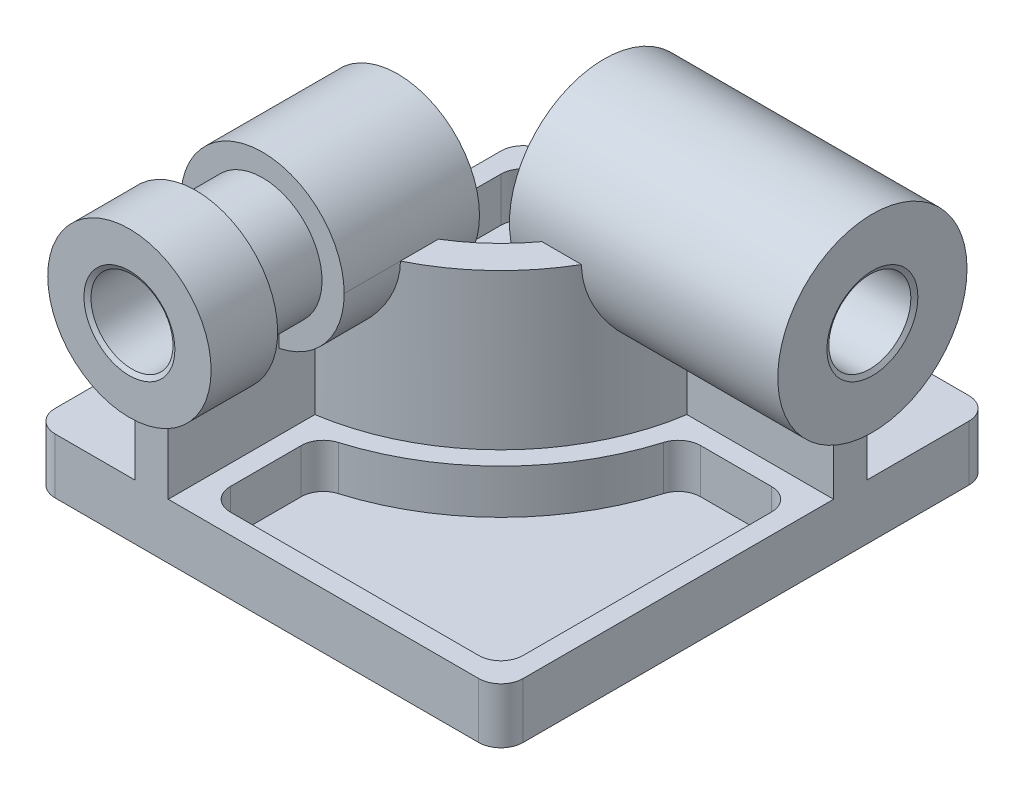
from build123d import *
from OCP.BRepFilletAPI import BRepFilletAPI_MakeChamfer

# Parameters (mm, degrees)
BOSS_EXTRUDE1_DEPTH = 25
BOSS_EXTRUDE2_START = -25
BOSS_EXTRUDE2_DEPTH = 95
BOSS_EXTRUDE4_START = 10
SKETCH7_R           = 36.833333333
BOSS_EXTRUDE4_DEPTH = 121
BOSS_EXTRUDE5_START = 10
SKETCH8_R           = 42.666666667
BOSS_EXTRUDE5_DEPTH = 121
CUT_EXTRUDE2_REACH  = 322.84
SKETCH9_R           = 18.5
CUT_EXTRUDE3_REACH  = 315.717
SKETCH10_R          = 18.5
CHAMFER1_SIZE       = 2
CHAMFER1_SIZE2      = 1.154700538
CUT_EXTRUDE4_START  = -30
CUT_EXTRUDE4_DEPTH  = 30
CUT_EXTRUDE5_DEPTH  = 20
CUT_EXTRUDE7_DEPTH  = 20


with BuildPart() as part:
    # Sketch1 → Boss-Extrude1 (new body)
    with BuildSketch(Plane(origin=(0, 0, 0), x_dir=(1, 0, 0), z_dir=(0, 1, 0))):
        with BuildLine():
            Line((-36, 56), (155, 56))
            ThreePointArc((155, 56), (162.071067812, 53.071067812), (165, 46))
            Line((165, 46), (165, -155))
            ThreePointArc((165, -155), (162.071067812, -162.071067812), (155, -165))
            Line((155, -165), (-36, -165))
            ThreePointArc((-36, -165), (-43.071067812, -162.071067812), (-46, -155))
            Line((-46, -155), (-46, 46))
            ThreePointArc((-46, 46), (-43.071067812, 53.071067812), (-36, 56))
        make_face()
    extrude(amount=BOSS_EXTRUDE1_DEPTH)

    # Sketch2 → Boss-Extrude2 (add)
    with BuildSketch(Plane(origin=(0, 25, 0), x_dir=(1, 0, 0), z_dir=(0, 1, 0)).offset(BOSS_EXTRUDE2_START)):
        with BuildLine():
            Line((0, -85), (0, -165))
            Line((0, -165), (15, -165))
            Line((15, -165), (15, -98.868599666))
            ThreePointArc((15, -98.868599666), (70.710678119, -70.710678119), (98.868599666, -15))
            Line((98.868599666, -15), (165, -15))
            Line((165, -15), (165, 0))
            Line((165, 0), (85, 0))
            ThreePointArc((85, 0), (60.104076401, -60.104076401), (0, -85))
        make_face()
    extrude(amount=BOSS_EXTRUDE2_DEPTH)

    # Sketch7 → Boss-Extrude4 (add)
    with BuildSketch(Plane.XY.offset(165).offset(BOSS_EXTRUDE4_START)):
        with Locations((7.5, 95)):
            Circle(SKETCH7_R)
    extrude(amount=-BOSS_EXTRUDE4_DEPTH)

    # Sketch8 → Boss-Extrude5 (add)
    with BuildSketch(Plane(origin=(165, 0, 0), x_dir=(0, 0, -1), z_dir=(1, 0, 0)).offset(BOSS_EXTRUDE5_START)):
        with Locations((-7.5, 95)):
            Circle(SKETCH8_R)
    extrude(amount=-BOSS_EXTRUDE5_DEPTH)

    # Sketch9 → Cut-Extrude2 (cut, up to next)
    with BuildSketch(Plane.XY.offset(175), mode=Mode.PRIVATE) as cut_extrude2_sk1:
        with Locations((7.5, 95)):
            Circle(SKETCH9_R)
    cut_extrude2_tool1 = extrude(cut_extrude2_sk1.sketch, amount=-CUT_EXTRUDE2_REACH, mode=Mode.PRIVATE) & part.part
    add(cut_extrude2_tool1.solids().sort_by_distance((7.5, 95, 175))[0], mode=Mode.SUBTRACT)

    # Sketch10 → Cut-Extrude3 (cut, up to next)
    with BuildSketch(Plane(origin=(175, 0, 0), x_dir=(0, 0, -1), z_dir=(1, 0, 0)), mode=Mode.PRIVATE) as cut_extrude3_sk1:
        with Locations((-7.5, 95)):
            Circle(SKETCH10_R)
    cut_extrude3_tool1 = extrude(cut_extrude3_sk1.sketch, amount=-CUT_EXTRUDE3_REACH, mode=Mode.PRIVATE) & part.part
    add(cut_extrude3_tool1.solids().sort_by_distance((175, 95, 7.5))[0], mode=Mode.SUBTRACT)

    # Chamfer1: one chamfer whose edges measure the first distance from different faces: ONE call of the kernel's chamfer builder (chamfer() names one face for all edges)
    chamfer1_edges_1 = [part.edges().sort_by_distance(p)[0] for p in [
        (-11, 95, 175),
    ]]
    chamfer1_side_1 = [part.faces().sort_by_distance(p)[0] for p in [
        (-28.291529342, 95, 175),
    ]]
    chamfer1_edges_2 = [part.edges().sort_by_distance(p)[0] for p in [
        (-11, 95, 54),
    ]]
    chamfer1_side_2 = [part.faces().sort_by_distance(p)[0] for p in [
        (-28.291529342, 95, 54),
    ]]
    chamfer1_edges_3 = [part.edges().sort_by_distance(p)[0] for p in [
        (175, 95, 26),
    ]]
    chamfer1_side_3 = [part.faces().sort_by_distance(p)[0] for p in [
        (175, 95, 48.959871093),
    ]]
    chamfer1_edges_4 = [part.edges().sort_by_distance(p)[0] for p in [
        (54, 95, 26),
    ]]
    chamfer1_side_4 = [part.faces().sort_by_distance(p)[0] for p in [
        (54, 95, 48.959871093),
    ]]
    chamfer1 = BRepFilletAPI_MakeChamfer(part.part.solid().wrapped)
    for e in chamfer1_edges_1:
        chamfer1.Add(CHAMFER1_SIZE, CHAMFER1_SIZE2, e.wrapped, chamfer1_side_1[0].wrapped)  # the first distance lies on this face
    for e in chamfer1_edges_2:
        chamfer1.Add(CHAMFER1_SIZE, CHAMFER1_SIZE2, e.wrapped, chamfer1_side_2[0].wrapped)  # the first distance lies on this face
    for e in chamfer1_edges_3:
        chamfer1.Add(CHAMFER1_SIZE, CHAMFER1_SIZE2, e.wrapped, chamfer1_side_3[0].wrapped)  # the first distance lies on this face
    for e in chamfer1_edges_4:
        chamfer1.Add(CHAMFER1_SIZE, CHAMFER1_SIZE2, e.wrapped, chamfer1_side_4[0].wrapped)  # the first distance lies on this face
    add(Compound.cast(chamfer1.Shape()), mode=Mode.REPLACE)

    # Sketch11 → Cut-Extrude4 (cut)
    with BuildSketch(Plane.XY.offset(175).offset(CUT_EXTRUDE4_START)):
        with BuildLine():
            Line((0, 58.938324437), (0, 69.236114855))
            ThreePointArc((0, 69.236114855), (7.5, 121.833333333), (15, 69.236114855))
            Line((15, 69.236114855), (15, 58.938324437))
            ThreePointArc((15, 58.938324437), (7.5, 131.833333333), (0, 58.938324437))
        make_face()
    extrude(amount=-CUT_EXTRUDE4_DEPTH, mode=Mode.SUBTRACT)

    # Sketch12 → Cut-Extrude5 (cut)
    with BuildSketch(Plane(origin=(0, 25, 0), x_dir=(1, 0, 0), z_dir=(0, 1, 0))):
        with BuildLine():
            Line((24, -114.039466852), (24, -146))
            ThreePointArc((24, -146), (26.928932188, -153.071067812), (34, -156))
            Line((34, -156), (146, -156))
            ThreePointArc((146, -156), (153.071067812, -153.071067812), (156, -146))
            Line((156, -146), (156, -34))
            ThreePointArc((156, -34), (153.071067812, -26.928932188), (146, -24))
            Line((146, -24), (114.039466852, -24))
            ThreePointArc((114.039466852, -24), (108.063323806, -25.982162743), (104.456318377, -31.142857143))
            ThreePointArc((104.456318377, -31.142857143), (77.074639149, -77.074639149), (31.142857143, -104.456318377))
            ThreePointArc((31.142857143, -104.456318377), (25.982162743, -108.063323806), (24, -114.039466852))
        make_face()
    extrude(amount=-CUT_EXTRUDE5_DEPTH, mode=Mode.SUBTRACT)

    # Sketch13 → Cut-Extrude7 (cut)
    with BuildSketch(Plane(origin=(0, 25, 0), x_dir=(1, 0, 0), z_dir=(0, 1, 0))):
        with BuildLine():
            Line((76, 0), (76, 37))
            ThreePointArc((76, 37), (73.071067812, 44.071067812), (66, 47))
            Line((66, 47), (-27, 47))
            ThreePointArc((-27, 47), (-34.071067812, 44.071067812), (-37, 37))
            Line((-37, 37), (-37, -66))
            ThreePointArc((-37, -66), (-34.071067812, -73.071067812), (-27, -76))
            Line((-27, -76), (0, -76))
            ThreePointArc((0, -76), (53.74011537, -53.74011537), (76, 0))
        make_face()
    extrude(amount=-CUT_EXTRUDE7_DEPTH, mode=Mode.SUBTRACT)


solid = part.part
